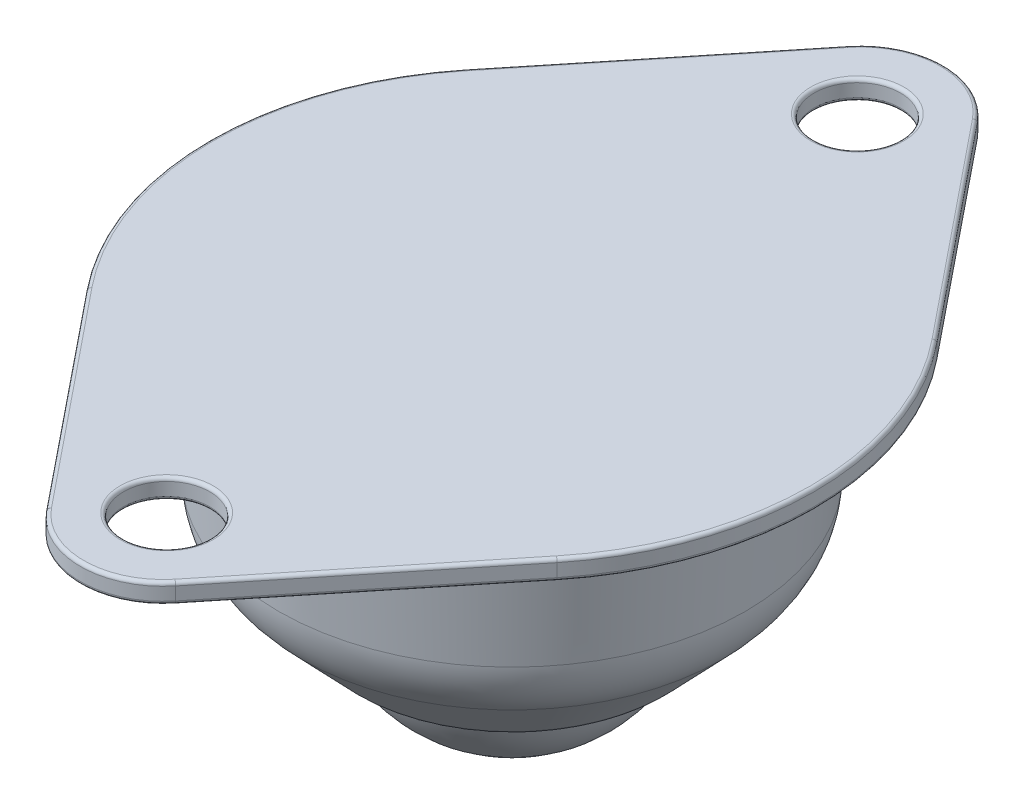
from build123d import *

# Parameters (mm, degrees)
FILLET1_R      = 1
FILLET2_R      = 5
SKETCH2_W      = 78.419719427
SKETCH2_H      = 65.605538268
EXTRUDE1_DEPTH = 10
SKETCH3_R      = 2.5
EXTRUDE2_DEPTH = 10
FILLET3_R      = 0.2


with BuildPart() as part:
    # Sketch1 → Revolve1 (revolve)
    with BuildSketch(Plane.XY, mode=Mode.PRIVATE) as revolve1_sk:
        with BuildLine():
            Line((0, 0), (26, 0))
            Line((26, 0), (26, -1.15))
            Line((26, -1.15), (14, -1.15))
            Line((14, -1.15), (13.4, -10))
            Line((13.4, -10), (8.599342077, -15))
            Line((8.599342077, -15), (7.599342077, -15))
            ThreePointArc((7.599342077, -15), (5.463720205, -18.343608605), (1.984313483, -20.25))
            Line((1.984313483, -20.25), (0, -20.25))
            Line((0, -20.25), (0, 0))
        make_face()
    revolve(revolve1_sk.sketch.rotate(Axis((0, -20.25, 0), (0, 1, 0)), 90), axis=Axis((0, -20.25, 0), (0, 1, 0)))

    # Fillet1
    fillet1_edges = [part.edges().sort_by_distance(p)[0] for p in [
        (0, -15, 8.599342077),
        (0, -1.15, 14),
    ]]
    fillet(fillet1_edges, radius=FILLET1_R)

    # Fillet2
    fillet2_edges = [part.edges().sort_by_distance(p)[0] for p in [
        (0, -10, 13.4),
    ]]
    fillet(fillet2_edges, radius=FILLET2_R)

    # Sketch2 → Extrude1 (cut)
    with BuildSketch(Plane(origin=(0, 0, 0), x_dir=(-1, 0, 0), z_dir=(0, 1, 0))):
        with Locations((-0.942236515, -0.511843557)):
            Rectangle(SKETCH2_W, SKETCH2_H)
        with BuildLine():
            Line((3.732660136, -23.217821782), (13.608656746, -11.002475248))
            ThreePointArc((13.608656746, -11.002475248), (17.5, 0), (13.608656746, 11.002475248))
            Line((13.608656746, 11.002475248), (3.732660136, 23.217821782))
            ThreePointArc((3.732660136, 23.217821782), (0, 25), (-3.732660136, 23.217821782))
            Line((-3.732660136, 23.217821782), (-13.608656746, 11.002475248))
            ThreePointArc((-13.608656746, 11.002475248), (-17.5, 0), (-13.608656746, -11.002475248))
            Line((-13.608656746, -11.002475248), (-3.732660136, -23.217821782))
            ThreePointArc((-3.732660136, -23.217821782), (0, -25), (3.732660136, -23.217821782))
        make_face(mode=Mode.SUBTRACT)
    extrude(amount=-EXTRUDE1_DEPTH, mode=Mode.SUBTRACT)

    # Sketch3 → Extrude2 (cut)
    with BuildSketch(Plane(origin=(0, 0, 0), x_dir=(1, 0, 0), z_dir=(0, 1, 0))):
        with Locations(Location((0, 20, 0), (0, 0, 270))):
            Circle(SKETCH3_R)
        with Locations(Location((0, -20, 0), (0, 0, 270))):
            Circle(SKETCH3_R)
    extrude(amount=-EXTRUDE2_DEPTH, mode=Mode.SUBTRACT)

    # Fillet3
    fillet3_edges = [part.edges().sort_by_distance(p)[0] for p in [
        (8.670658441, -1.15, -17.110148515),
        (0, -1.15, -25),
        (-8.670658441, -1.15, -17.110148515),
        (-17.5, -1.15, 0),
        (-8.670658441, -1.15, 17.110148515),
        (0, -1.15, 25),
        (8.670658441, -1.15, 17.110148515),
        (17.5, -1.15, 0),
        (17.5, 0, 0),
        (8.670658441, 0, 17.110148515),
        (0, 0, 25),
        (-8.670658441, 0, 17.110148515),
        (-17.5, 0, 0),
        (-8.670658441, 0, -17.110148515),
        (0, 0, -25),
        (8.670658441, 0, -17.110148515),
        (0, -1.15, -22.5),
        (0, 0, -22.5),
        (0, -1.15, 17.5),
        (0, 0, 17.5),
    ]]
    fillet(fillet3_edges, radius=FILLET3_R)


solid = part.part
